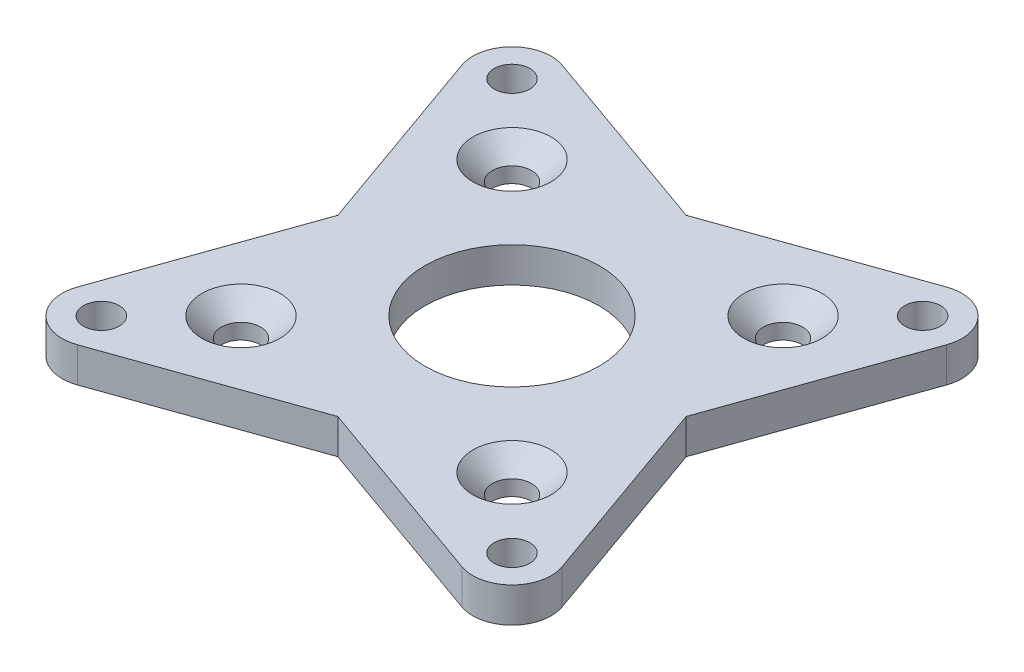
from build123d import *

# Parameters (mm, degrees)
SKETCH1_W                                    = 71.3
SKETCH1_H                                    = 60
BOSS_EXTRUDE1_DEPTH                          = 4
SKETCH2_R                                    = 2.05
CUT_EXTRUDE1_DEPTH                           = 47.764543192
SKETCH4_R                                    = 10
CUT_EXTRUDE3_DEPTH                           = 47.764543192
SKETCH5_OUTSIDE_W                            = 91.954
SKETCH5_OUTSIDE_H                            = 80.654
CUT_EXTRUDE4_DEPTH                           = 47.764543192
CSK_FOR_M4_HEX_SOCKET_COUNTERSUNK_CA_2_COUNT = 2
CSK_FOR_M4_HEX_SOCKET_COUNTERSUNK_CA_2_PITCH = 31.112698372
CSK_FOR_M4_HEX_SOCKET_COUNTERSUNK_CA_3_COUNT = 2
CSK_FOR_M4_HEX_SOCKET_COUNTERSUNK_CA_3_PITCH = 44
CSK_FOR_M4_HEX_SOCKET_COUNTERSUNK_CA_4_COUNT = 2
CSK_FOR_M4_HEX_SOCKET_COUNTERSUNK_CA_4_PITCH = 31.112698372


with BuildPart() as part:
    # Sketch1 → Boss-Extrude1 (new body)
    with BuildSketch(Plane(origin=(0, 0, 0), x_dir=(1, 0, 0), z_dir=(0, 1, 0))):
        Rectangle(SKETCH1_W, SKETCH1_H)
    extrude(amount=BOSS_EXTRUDE1_DEPTH)

    # Sketch2 → Cut-Extrude1 (cut, through all)
    with BuildSketch(Plane(origin=(0, 4, 0), x_dir=(1, 0, 0), z_dir=(0, 1, 0))):
        with Locations(Location((-15.556349186, 15.556349186, 0), (0, 0, 270))):
            Circle(SKETCH2_R)
        with Locations(Location((-23.57, 23.57, 0), (0, 0, 270))):
            Circle(SKETCH2_R)
        with Locations(Location((15.556349186, 15.556349186, 0), (0, 0, 270))):
            Circle(SKETCH2_R)
        with Locations(Location((23.57, 23.57, 0), (0, 0, 270))):
            Circle(SKETCH2_R)
        with Locations(Location((15.556349186, -15.556349186, 0), (0, 0, 270))):
            Circle(SKETCH2_R)
        with Locations(Location((23.57, -23.57, 0), (0, 0, 270))):
            Circle(SKETCH2_R)
        with Locations(Location((-15.556349186, -15.556349186, 0), (0, 0, 270))):
            Circle(SKETCH2_R)
        with Locations(Location((-23.57, -23.57, 0), (0, 0, 270))):
            Circle(SKETCH2_R)
    extrude(amount=-CUT_EXTRUDE1_DEPTH, mode=Mode.SUBTRACT)

    # Sketch4 → Cut-Extrude3 (cut, through all)
    with BuildSketch(Plane(origin=(0, 4, 0), x_dir=(1, 0, 0), z_dir=(0, 1, 0))):
        with Locations(Location((0, 0, 0), (0, 0, 270))):
            Circle(SKETCH4_R)
    extrude(amount=-CUT_EXTRUDE3_DEPTH, mode=Mode.SUBTRACT)

    # Sketch5 outside → Cut-Extrude4 (cut, through all)
    with BuildSketch(Plane(origin=(0, 4, 0), x_dir=(1, 0, 0), z_dir=(0, 1, 0))):
        Rectangle(SKETCH5_OUTSIDE_W, SKETCH5_OUTSIDE_H)
        with BuildLine():
            Line((20, 0), (27.812053359, 22.068339818))
            ThreePointArc((27.812053359, 22.068339818), (26.751980515, 26.751980515), (22.068339818, 27.812053359))
            Line((22.068339818, 27.812053359), (0, 20))
            Line((0, 20), (-22.068339818, 27.812053359))
            ThreePointArc((-22.068339818, 27.812053359), (-26.751980515, 26.751980515), (-27.812053359, 22.068339818))
            Line((-27.812053359, 22.068339818), (-20, 0))
            Line((-20, 0), (-27.812053359, -22.068339818))
            ThreePointArc((-27.812053359, -22.068339818), (-26.751980515, -26.751980515), (-22.068339818, -27.812053359))
            Line((-22.068339818, -27.812053359), (0, -20))
            Line((0, -20), (22.068339818, -27.812053359))
            ThreePointArc((22.068339818, -27.812053359), (26.751980515, -26.751980515), (27.812053359, -22.068339818))
            Line((27.812053359, -22.068339818), (20, 0))
        make_face(mode=Mode.SUBTRACT)
    extrude(amount=-CUT_EXTRUDE4_DEPTH, mode=Mode.SUBTRACT)

    # Sketch7 → CSK for M4 Hex Socket Countersunk Cap Screw1 (revolve, cut)
    with BuildSketch(Plane(origin=(-15.556349186, 4, -15.556349186), x_dir=(0, 0, 1), z_dir=(1, 0, 0))):
        Polygon((0, 0), (0, 4), (2.25, 4), (2.25, 2.23), (4.48, 0), align=None)
    csk_for_m4_hex_socket_countersunk_cap_sc = revolve(axis=Axis((-15.556349186, 10.35, -15.556349186), (0, -1, 0)), mode=Mode.SUBTRACT)

    # CSK for M4 Hex Socket Countersunk Ca 2: CSK for M4 Hex Socket Countersunk Cap Screw1 ×2
    with Locations(*[(i * CSK_FOR_M4_HEX_SOCKET_COUNTERSUNK_CA_2_PITCH, 0, 0) for i in range(1, CSK_FOR_M4_HEX_SOCKET_COUNTERSUNK_CA_2_COUNT)]):
        add(csk_for_m4_hex_socket_countersunk_cap_sc, mode=Mode.SUBTRACT)

    # CSK for M4 Hex Socket Countersunk Ca 3: CSK for M4 Hex Socket Countersunk Cap Screw1 ×2
    with Locations(*[Vector(0.7071067811865476, 0, 0.7071067811865476) * (i * CSK_FOR_M4_HEX_SOCKET_COUNTERSUNK_CA_3_PITCH) for i in range(1, CSK_FOR_M4_HEX_SOCKET_COUNTERSUNK_CA_3_COUNT)]):
        add(csk_for_m4_hex_socket_countersunk_cap_sc, mode=Mode.SUBTRACT)

    # CSK for M4 Hex Socket Countersunk Ca 4: CSK for M4 Hex Socket Countersunk Cap Screw1 ×2
    with Locations(*[(0, 0, i * CSK_FOR_M4_HEX_SOCKET_COUNTERSUNK_CA_4_PITCH) for i in range(1, CSK_FOR_M4_HEX_SOCKET_COUNTERSUNK_CA_4_COUNT)]):
        add(csk_for_m4_hex_socket_countersunk_cap_sc, mode=Mode.SUBTRACT)


solid = part.part
